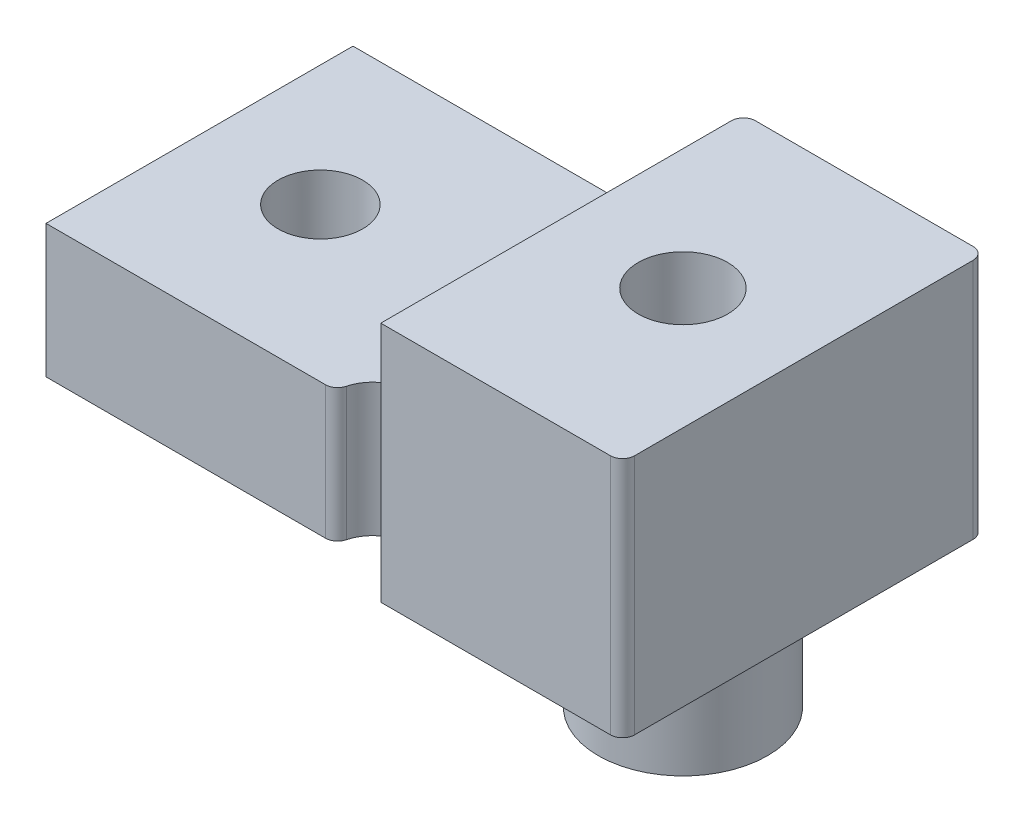
from build123d import *
from build123d.topology import SkipClean

# Parameters (mm, degrees)
SKETCH1_R           = 1.75
BOSS_EXTRUDE1_DEPTH = 10
SKETCH2_W           = 15
SKETCH2_H           = 12.7
CUT_EXTRUDE1_DEPTH  = 4.5
FILLET1_R           = 0.5
BOSS_EXTRUDE2_START = 5
SKETCH3_R           = 3.5
SKETCH3_R_2         = 1.75
BOSS_EXTRUDE2_DEPTH = 5
SKETCH4_R           = 1.85
CUT_EXTRUDE2_DEPTH  = 33.277275288
SKETCH5_R           = 1.95
CUT_EXTRUDE3_DEPTH  = 4


with BuildPart() as part:
    # Sketch1 → Boss-Extrude1 (new body)
    with BuildSketch(Plane(origin=(0, 0, 0), x_dir=(1, 0, 0), z_dir=(0, 1, 0))):
        with BuildLine():
            Line((0, 0), (12, 0))
            ThreePointArc((12, 0), (13.5, 1.5), (15, 0))
            Line((15, 0), (15, -1.15))
            Line((15, -1.15), (25, -1.15))
            Line((25, -1.15), (25, 13.85))
            Line((25, 13.85), (15, 13.85))
            Line((15, 13.85), (15, 12.7))
            ThreePointArc((15, 12.7), (13.5, 11.2), (12, 12.7))
            Line((12, 12.7), (0, 12.7))
            Line((0, 12.7), (0, 0))
        make_face()
        with Locations(Location((5, 6.35, 0), (0, 0, 270))):
            Circle(SKETCH1_R, mode=Mode.SUBTRACT)
        with Locations(Location((20, 6.35, 0), (0, 0, 270))):
            Circle(SKETCH1_R, mode=Mode.SUBTRACT)
    extrude(amount=BOSS_EXTRUDE1_DEPTH)

    # Sketch2 → Cut-Extrude1 (cut)
    with BuildSketch(Plane(origin=(0, 10, 0), x_dir=(1, 0, 0), z_dir=(0, 1, 0))):
        with Locations((7.5, 6.35)):
            Rectangle(SKETCH2_W, SKETCH2_H)
    extrude(amount=-CUT_EXTRUDE1_DEPTH, mode=Mode.SUBTRACT)

    # Fillet1
    fillet1_edges = [part.edges().sort_by_distance(p)[0] for p in [
        (15, 5, -13.85),
        (25, 5, -13.85),
        (25, 5, 1.15),
        (12, 2.75, -12.7),
        (12, 2.75, 0),
    ]]
    fillet(fillet1_edges, radius=FILLET1_R)

    # Sketch3 → Boss-Extrude2 (add)
    with SkipClean():  # the faces are left unmerged after this step: merging them gives an invalid solid
        with BuildSketch(Plane.XZ.offset(BOSS_EXTRUDE2_START)):
            with Locations(Location((20, -6.35, 0), (0, 0, 270))):
                Circle(SKETCH3_R)
            with Locations(Location((20, -6.35, 0), (0, 0, 270))):
                Circle(SKETCH3_R_2, mode=Mode.SUBTRACT)
        extrude(amount=-BOSS_EXTRUDE2_DEPTH)

    # Sketch4 → Cut-Extrude2 (cut, through all)
    with BuildSketch(Plane.XZ.offset(5)):
        with Locations(Location((20, -6.35, 0), (0, 0, 270))):
            Circle(SKETCH4_R)
    extrude(amount=-CUT_EXTRUDE2_DEPTH, mode=Mode.SUBTRACT)

    # Sketch5 → Cut-Extrude3 (cut)
    with BuildSketch(Plane.XZ.offset(5)):
        with Locations(Location((20, -6.35, 0), (0, 0, 270))):
            Circle(SKETCH5_R)
    extrude(amount=-CUT_EXTRUDE3_DEPTH, mode=Mode.SUBTRACT)


solid = part.part
